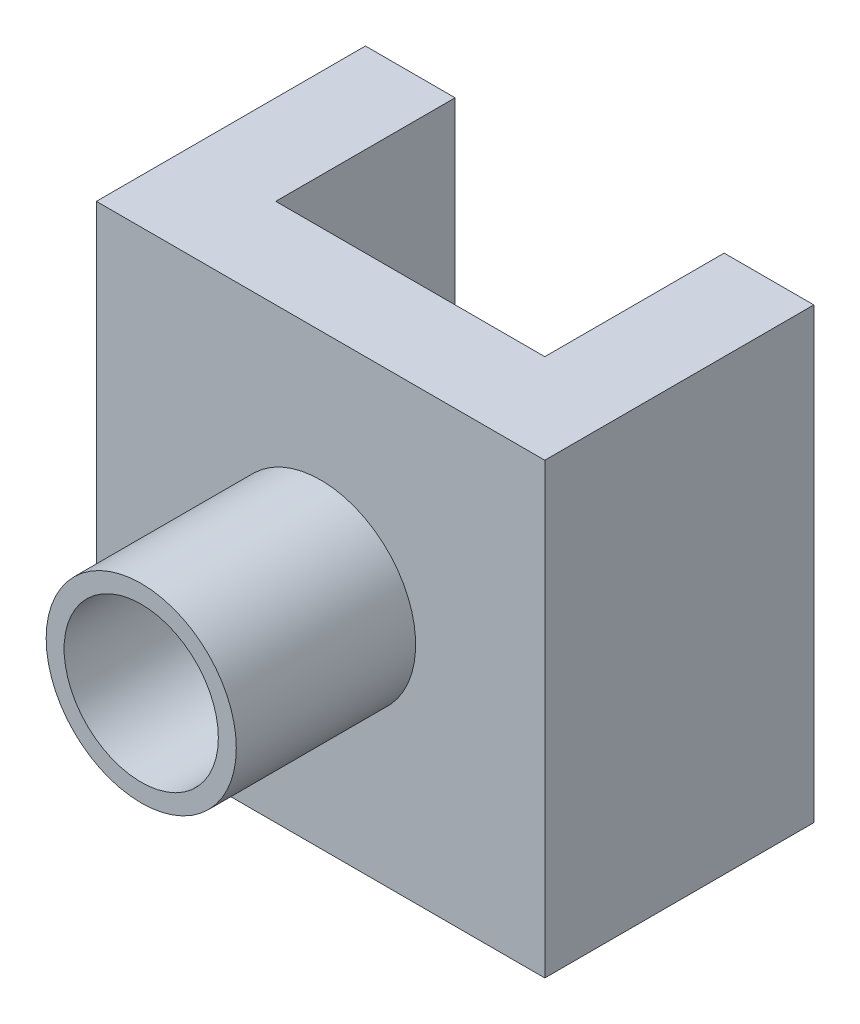
from build123d import *

# Parameters (mm, degrees)
SKETCH1_W           = 25
SKETCH1_H           = 25
BOSS_EXTRUDE1_DEPTH = 15
SKETCH2_R           = 4.3
CUT_EXTRUDE1_DEPTH  = 39.405728739
BOSS_EXTRUDE2_START = 10
SKETCH3_R           = 5.3
SKETCH3_R_2         = 4.3
BOSS_EXTRUDE2_DEPTH = 10
SKETCH4_W           = 15
SKETCH4_H           = 10
CUT_EXTRUDE2_DEPTH  = 28


with BuildPart() as part:
    # Sketch1 → Boss-Extrude1 (new body)
    with BuildSketch(Plane.XY):
        with Locations((12.5, 12.5)):
            Rectangle(SKETCH1_W, SKETCH1_H)
    extrude(amount=BOSS_EXTRUDE1_DEPTH)

    # Sketch2 → Cut-Extrude1 (cut, through all)
    with BuildSketch(Plane.XY.offset(15)):
        with Locations((12.5, 12.5)):
            Circle(SKETCH2_R)
    extrude(amount=-CUT_EXTRUDE1_DEPTH, mode=Mode.SUBTRACT)

    # Sketch3 → Boss-Extrude2 (add)
    with BuildSketch(Plane.XY.offset(15).offset(BOSS_EXTRUDE2_START)):
        with Locations(Location((12.5, 12.5, 0), (0, 0, 180))):
            Circle(SKETCH3_R)
        with Locations((12.5, 12.5)):
            Circle(SKETCH3_R_2, mode=Mode.SUBTRACT)
    extrude(amount=-BOSS_EXTRUDE2_DEPTH)

    # Sketch4 → Cut-Extrude2 (cut)
    with BuildSketch(Plane(origin=(0, 25, 0), x_dir=(1, 0, 0), z_dir=(0, 1, 0))):
        with Locations((12.5, -5)):
            Rectangle(SKETCH4_W, SKETCH4_H)
    extrude(amount=-CUT_EXTRUDE2_DEPTH, mode=Mode.SUBTRACT)


solid = part.part
